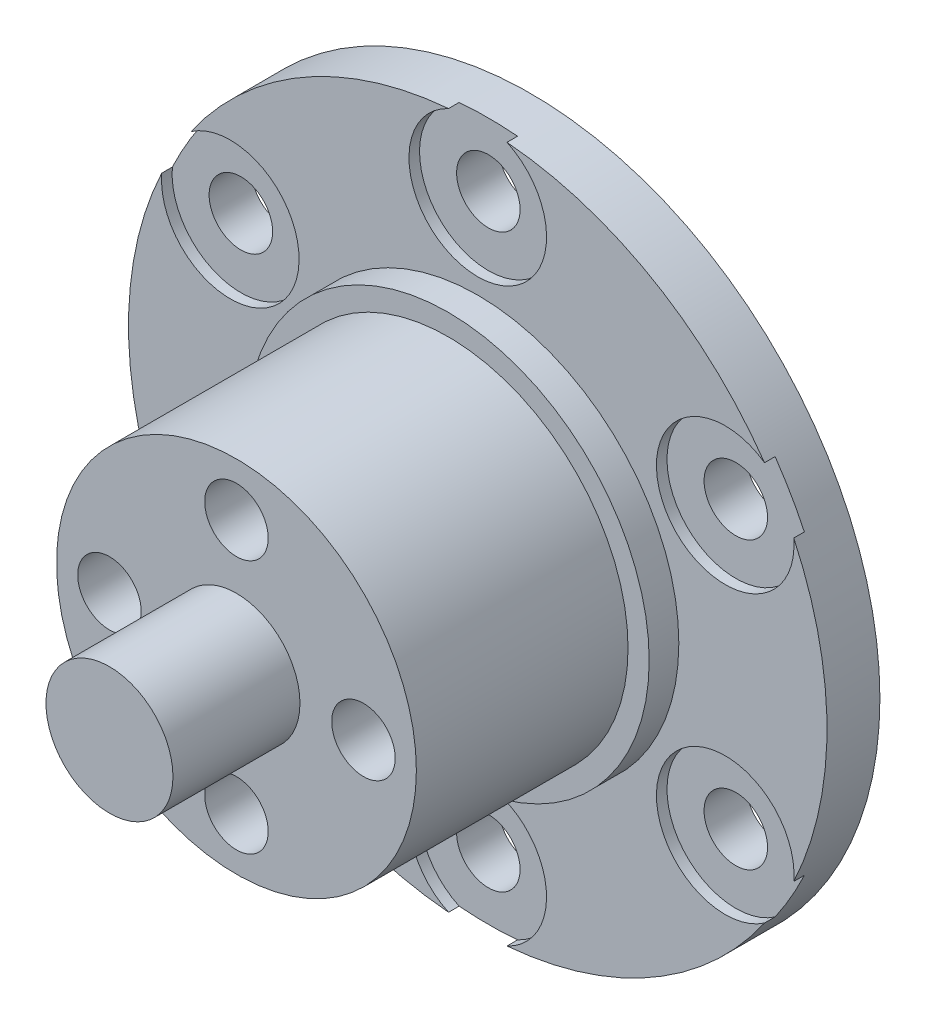
from build123d import *

# Parameters (mm, degrees)
SKETCH_1_R               = 16.5
EXTRUDE_1_DEPTH          = 2.5
SKETCH_2_R               = 9.5
EXTRUDE_2_DEPTH          = 1.4
SKETCH_3_R               = 1.5
CUT_EXTRUDE_1_DEPTH      = 3
SKETCH_4_R               = 8.5
EXTRUDE_3_DEPTH          = 10
PATTERN_CIRCULAR_1_COUNT = 4
SKETCH_8_R               = 3
EXTRUDE_4_DEPTH          = 6
SKETCH_9_R               = 3.25
CUT_EXTRUDE_2_DEPTH      = 0.5


with BuildPart() as part:
    # 草图1 → 凸台-拉伸1 (new body)
    with BuildSketch(Plane.XY):
        Circle(SKETCH_1_R)
    extrude(amount=EXTRUDE_1_DEPTH)

    # 草图2 → 凸台-拉伸2 (add)
    with BuildSketch(Plane.XY.offset(2.5)):
        Circle(SKETCH_2_R)
    extrude(amount=EXTRUDE_2_DEPTH)

    # 草图3 → 切除-拉伸1 (cut)
    with BuildSketch(Plane.XY.offset(2.5)):
        with Locations((0, 13.5)):
            Circle(SKETCH_3_R)
        with Locations((11.691342951, 6.75)):
            Circle(SKETCH_3_R)
        with Locations((11.691342951, -6.75)):
            Circle(SKETCH_3_R)
        with Locations((0, -13.5)):
            Circle(SKETCH_3_R)
        with Locations((-11.691342951, -6.75)):
            Circle(SKETCH_3_R)
        with Locations((-11.691342951, 6.75)):
            Circle(SKETCH_3_R)
    extrude(amount=-CUT_EXTRUDE_1_DEPTH, mode=Mode.SUBTRACT)

    # 草图4 → 凸台-拉伸3 (add)
    with BuildSketch(Plane.XY.offset(3.9)):
        Circle(SKETCH_4_R)
    extrude(amount=EXTRUDE_3_DEPTH)

    # 草图7 → M3 螺纹孔1 (revolve, cut)
    with BuildSketch(Plane(origin=(0, 6, 13.9), x_dir=(0, -1, 0), z_dir=(1, 0, 0))):
        Polygon((0, 0), (0, 8.401290929), (1.5, 7.5), (1.5, 0), align=None)
    hole_wizard_m3_1 = revolve(axis=Axis((0, 6, 20.25), (0, 0, -1)), mode=Mode.SUBTRACT)

    # 阵列(圆周)1: M3 螺纹孔1 ×4 about axis
    pattern_circular_1_axis = Axis((0, 0, 0), (0, 0, 1))
    for i in range(1, PATTERN_CIRCULAR_1_COUNT):
        add(hole_wizard_m3_1.rotate(pattern_circular_1_axis, i * 360 / PATTERN_CIRCULAR_1_COUNT), mode=Mode.SUBTRACT)

    # 草图8 → 凸台-拉伸4 (add)
    with BuildSketch(Plane.XY.offset(13.9)):
        Circle(SKETCH_8_R)
    extrude(amount=EXTRUDE_4_DEPTH)

    # 草图9 → 切除-拉伸2 (cut)
    with BuildSketch(Plane.XY.offset(2.5)):
        with Locations((0, 13.5)):
            Circle(SKETCH_9_R)
        with Locations((11.691342951, 6.75)):
            Circle(SKETCH_9_R)
        with Locations((11.691342951, -6.75)):
            Circle(SKETCH_9_R)
        with Locations((0, -13.5)):
            Circle(SKETCH_9_R)
        with Locations((-11.691342951, -6.75)):
            Circle(SKETCH_9_R)
        with Locations((-11.691342951, 6.75)):
            Circle(SKETCH_9_R)
    extrude(amount=-CUT_EXTRUDE_2_DEPTH, mode=Mode.SUBTRACT)


solid = part.part
